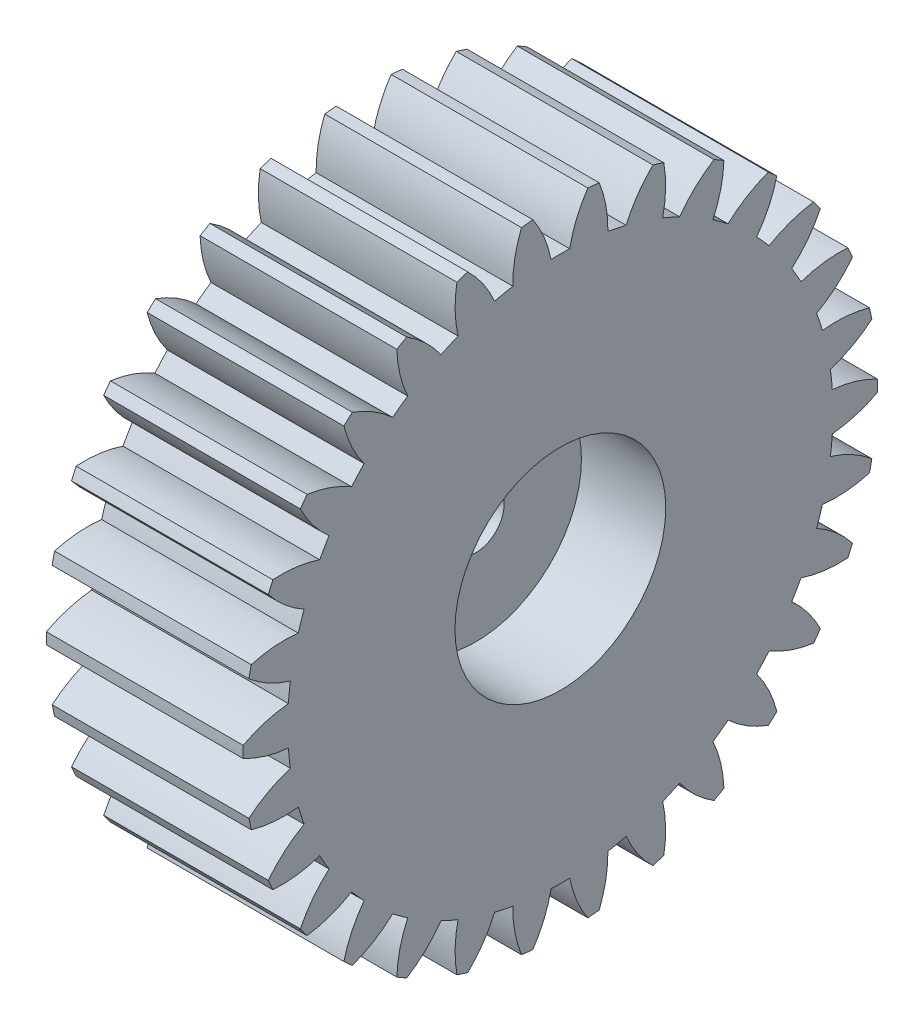
from build123d import *

# Parameters (mm, degrees)
CORTAR_EXTRUIR1_DEPTH = 53.296840919
MATRIZC1_COUNT        = 30
ESCALA1_SCALE         = 0.25


with BuildPart() as part:
    # Croquis1 → Revolución1 (revolve)
    with BuildSketch(Plane.XY, mode=Mode.PRIVATE) as revoluci_n1_sk:
        Polygon((0, 11.25), (0, 3), (-5, 3), (-5, 7), (-12, 7), (-12, 33.86709), (9, 33.86709), (9, 11.25), align=None)
    revolve(revoluci_n1_sk.sketch.rotate(Axis((0, 0, 0), (-1, 0, 0)), 90), axis=Axis((0, 0, 0), (-1, 0, 0)))

    # Croquis2 → Cortar-Extruir1 (cut, through all)
    with BuildSketch(Plane(origin=(9, 0, 0), x_dir=(0, 0, -1), z_dir=(1, 0, 0))):
        with BuildLine():
            ThreePointArc((2.94894, 33.762679781), (0, 33.89122), (-2.94894, 33.762679781))
            ThreePointArc((-2.94894, 33.762679781), (-1.736711151, 31.522896824), (-0.995746775, 29.086280673))
            ThreePointArc((-0.995746775, 29.086280673), (-6.6814e-05, 29.10332), (0.995613225, 29.086285245))
            ThreePointArc((0.995613225, 29.086285245), (1.73672827, 31.522870893), (2.94894, 33.762679781))
        make_face()
    cortar_extruir1 = extrude(amount=-CORTAR_EXTRUIR1_DEPTH, mode=Mode.SUBTRACT)

    # MatrizC1: Cortar-Extruir1 ×30 about axis
    matrizc1_axis = Axis((0, 0, 0), (1, 0, 0))
    for i in range(1, MATRIZC1_COUNT):
        add(cortar_extruir1.rotate(matrizc1_axis, i * 360 / MATRIZC1_COUNT), mode=Mode.SUBTRACT)


with BuildPart() as part_1:
    # Escala1: scaled about (-1.729294064, 0, 0)
    add(part.part.scale(ESCALA1_SCALE).moved(Location((-1.296970548, 0, 0))))


solid = part_1.part
